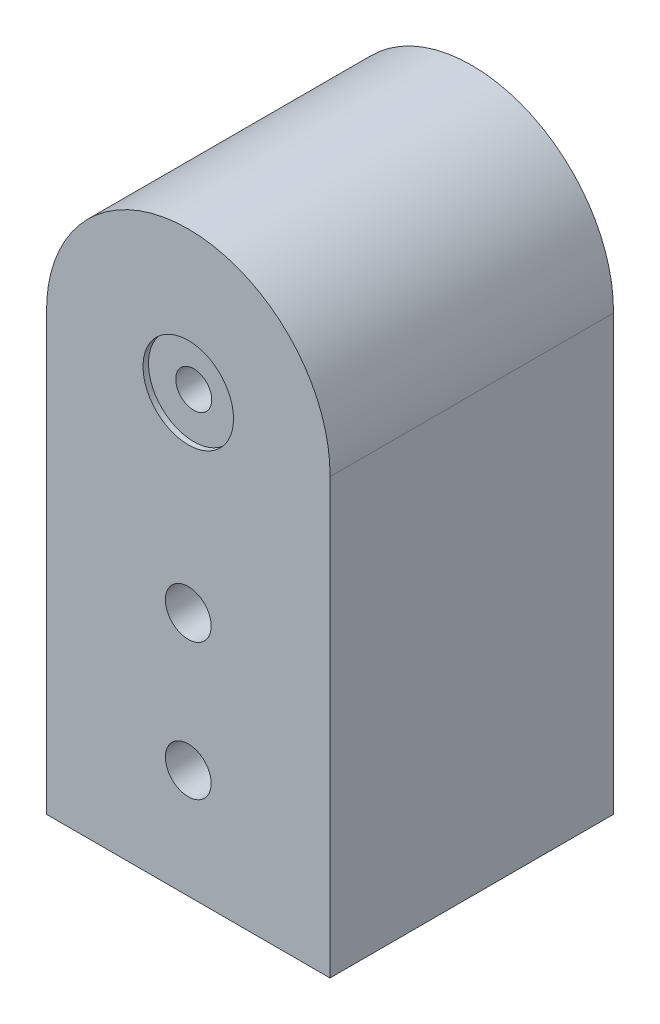
from build123d import *

# Parameters (mm, degrees)
EXTRUDE_1_DEPTH     = 26
SKETCH_3_W          = 20
SKETCH_3_H          = 20
CUT_EXTRUDE_1_DEPTH = 30
SKETCH_4_R          = 1.65
CUT_EXTRUDE_2_DEPTH = 69.713384893
SKETCH_4_3_R        = 4.15
SKETCH_4_3_R_2      = 1.65
CUT_EXTRUDE_3_DEPTH = 0.5
CUT_EXTRUDE_START   = -25.5
SKETCH_4_4_R        = 4.15
SKETCH_4_4_R_2      = 1.65
CUT_EXTRUDE_4_DEPTH = 0.5
SKETCH_5_R          = 2.1
CUT_EXTRUDE_5_DEPTH = 69.713384893
CUT_EXTRUDE_START_2 = -67
CUT_EXTRUDE_6_DEPTH = 67


with BuildPart() as part:
    # 草图2 → 凸台-拉伸1 (new body)
    with BuildSketch(Plane.XY):
        with BuildLine():
            Line((0, 0), (0, 30))
            ThreePointArc((0, 30), (13, 56.401219467), (26, 30))
            Line((26, 30), (26, 0))
            Line((26, 0), (0, 0))
        make_face()
    extrude(amount=EXTRUDE_1_DEPTH)

    # 草图3 → 切除-拉伸1 (cut)
    with BuildSketch(Plane.XZ):
        with Locations((13, 13)):
            Rectangle(SKETCH_3_W, SKETCH_3_H)
    extrude(amount=-CUT_EXTRUDE_1_DEPTH, mode=Mode.SUBTRACT)

    # 草图4 → 切除-拉伸2 (cut, through all)
    with BuildSketch(Plane.XY.offset(26)):
        with Locations((13, 40)):
            Circle(SKETCH_4_R)
    extrude(amount=-CUT_EXTRUDE_2_DEPTH, mode=Mode.SUBTRACT)

    # 草图4<3> → 切除-拉伸3 (cut)
    with BuildSketch(Plane.XY.offset(26)):
        with Locations((13, 40)):
            Circle(SKETCH_4_3_R)
        with Locations((13, 40)):
            Circle(SKETCH_4_3_R_2, mode=Mode.SUBTRACT)
    extrude(amount=-CUT_EXTRUDE_3_DEPTH, mode=Mode.SUBTRACT)

    # 草图4<4> → 切除-拉伸4 (cut)
    with BuildSketch(Plane.XY.offset(26).offset(CUT_EXTRUDE_START)):
        with Locations((13, 40)):
            Circle(SKETCH_4_4_R)
        with Locations((13, 40)):
            Circle(SKETCH_4_4_R_2, mode=Mode.SUBTRACT)
    extrude(amount=-CUT_EXTRUDE_4_DEPTH, mode=Mode.SUBTRACT)

    # 草图5 → 切除-拉伸5 (cut, through all)
    with BuildSketch(Plane.XY.offset(26)):
        with Locations((13, 22.5)):
            Circle(SKETCH_5_R)
        with Locations((13, 10)):
            Circle(SKETCH_5_R)
    extrude(amount=-CUT_EXTRUDE_5_DEPTH, mode=Mode.SUBTRACT)

    # 草图6 → 切除-拉伸6 (cut)
    with BuildSketch(Plane.XY.offset(26).offset(CUT_EXTRUDE_START_2)):
        with BuildLine():
            Line((0, 30), (0, 39.821933649))
            ThreePointArc((0, 39.821933649), (13, 53.001219467), (26, 39.821933649))
            Line((26, 39.821933649), (26, 30))
            ThreePointArc((26, 30), (13, 56.401219467), (0, 30))
        make_face()
    extrude(amount=CUT_EXTRUDE_6_DEPTH, mode=Mode.SUBTRACT)


solid = part.part
